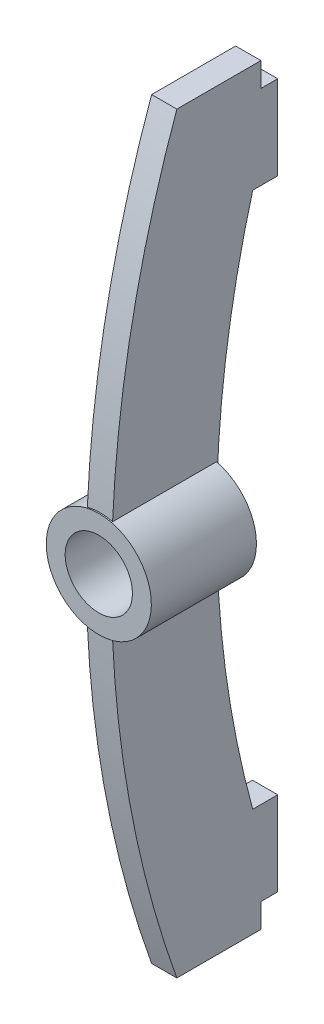
from build123d import *

# Parameters (mm, degrees)
BOSS_EXTRUDE1_DEPTH = 6
SKETCH2_W           = 50
SKETCH2_H           = 25
SKETCH3_R           = 16
CUT_EXTRUDE1_DEPTH  = 198.288440507


with BuildPart() as part:
    # Sketch1 → Boss-Extrude1 (new, symmetric)
    with BuildSketch(Plane(origin=(0, 0, 0), x_dir=(0, 0, -1), z_dir=(1, 0, 0))):
        with BuildLine():
            Line((0, 167.5), (-8, 167.5))
            Line((-8, 167.5), (-8, 178.988731807))
            Line((-8, 178.988731807), (-48, 178.988731807))
            ThreePointArc((-48, 178.988731807), (-79.124980803, 0), (-48, -178.988731807))
            Line((-48, -178.988731807), (-8, -178.988731807))
            Line((-8, -178.988731807), (-8, -167.5))
            Line((-8, -167.5), (0, -167.5))
            Line((0, -167.5), (0, -127.5))
            Line((0, -127.5), (-11.889594458, -127.5))
            ThreePointArc((-11.889594458, -127.5), (-29.124980803, 0), (-11.889594458, 127.5))
            Line((-11.889594458, 127.5), (0, 127.5))
            Line((0, 127.5), (0, 167.5))
        make_face()
    extrude(amount=BOSS_EXTRUDE1_DEPTH, both=True)

    # Sketch2 → Revolve1 (revolve)
    with BuildSketch(Plane(origin=(0, 0, 0), x_dir=(0, 0, -1), z_dir=(1, 0, 0))):
        with Locations((-54.124980803, 12.5)):
            Rectangle(SKETCH2_W, SKETCH2_H)
    revolve(axis=Axis((0, 0, 29.124980803), (0, 0, 1)))

    # Sketch3 → Cut-Extrude1 (cut, through all)
    with BuildSketch(Plane.XY):
        with Locations(Location((0, 0, 0), (0, 0, 247.975687163))):
            Circle(SKETCH3_R)
    extrude(amount=CUT_EXTRUDE1_DEPTH, mode=Mode.SUBTRACT)


solid = part.part
